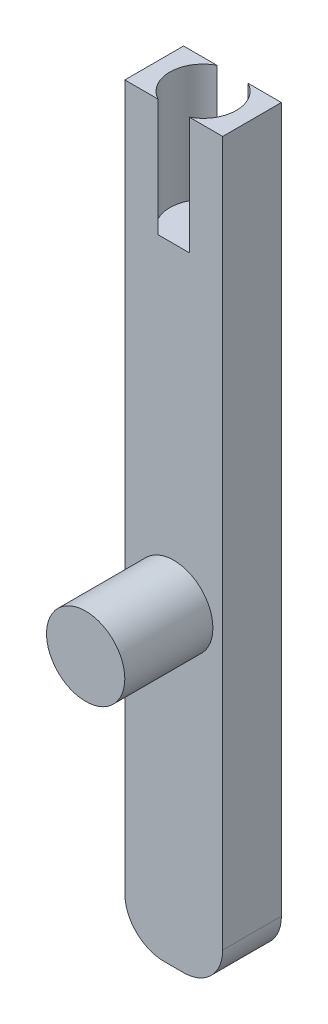
from build123d import *

# Parameters (mm, degrees)
EXTRUDE_1_DEPTH     = 1.5
SKETCH_2_R          = 1
EXTRUDE_2_DEPTH     = 2.25
SKETCH_3_R          = 0.85
CUT_EXTRUDE_1_DEPTH = 3


with BuildPart() as part:
    # Эскиз1 → Бобышка-Вытянуть1 (new body)
    with BuildSketch(Plane.XY):
        with BuildLine():
            Line((-1, 0), (-1.5, 0))
            ThreePointArc((-1.5, 0), (-2.207106781, 0.292893219), (-2.5, 1))
            Line((-2.5, 1), (-2.5, 19))
            Line((-2.5, 19), (0, 19))
            Line((0, 19), (0, 1))
            ThreePointArc((0, 1), (-0.292893219, 0.292893219), (-1, 0))
        make_face()
    extrude(amount=EXTRUDE_1_DEPTH)

    # Эскиз2 → Бобышка-Вытянуть2 (add)
    with BuildSketch(Plane.XY.offset(1.5)):
        with Locations((-1.25, 8)):
            Circle(SKETCH_2_R)
    extrude(amount=EXTRUDE_2_DEPTH)

    # Эскиз3 → Вырез-Вытянуть1 (cut)
    with BuildSketch(Plane(origin=(0, 19, 0), x_dir=(1, 0, 0), z_dir=(0, 1, 0))):
        with Locations((-1.25, -0.75)):
            Circle(SKETCH_3_R)
    extrude(amount=-CUT_EXTRUDE_1_DEPTH, mode=Mode.SUBTRACT)


solid = part.part
